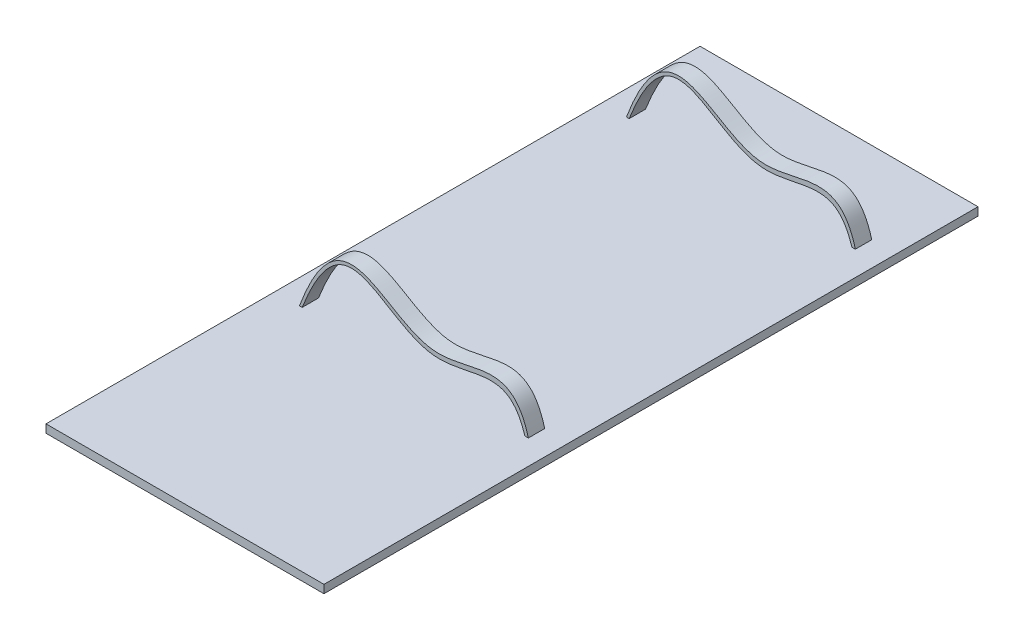
from build123d import *

# Parameters (mm, degrees)
SKETCH1_W           = 85
SKETCH1_H           = 200
BOSS_EXTRUDE1_DEPTH = 2.5
BOSS_EXTRUDE3_DEPTH = 5
LPATTERN1_COUNT     = 2
LPATTERN1_PITCH     = 100


with BuildPart() as part:
    # Sketch1 → Boss-Extrude1 (new body)
    with BuildSketch(Plane(origin=(0, 0, 0), x_dir=(1, 0, 0), z_dir=(0, 1, 0))):
        with Locations((42.5, 100)):
            Rectangle(SKETCH1_W, SKETCH1_H)
    extrude(amount=BOSS_EXTRUDE1_DEPTH)

    # Sketch3 → Boss-Extrude3 (add)
    with BuildSketch(Plane(origin=(0, 0, -175), x_dir=(-1, 0, 0), z_dir=(0, 0, -1))):
        with BuildLine():
            Line((-77.5, 2.5), (-76.450132059, 2.5))
            add(Edge.make_bspline(
                [(-76.450132059, 2.5), (-76.352037023, 2.813155952), (-76.141653781, 3.448774979), (-75.712920238, 4.60640845), (-75.141711698, 5.914949297), (-74.412627596, 7.255247487), (-73.387535674, 8.763975464), (-72.02254847, 10.166201705), (-70.263673421, 11.232606933), (-68.348427729, 11.819901852), (-65.552395249, 12.079641822), (-61.64077912, 11.600566429), (-56.547104343, 10.479098709), (-52.154053067, 9.794168924), (-48.61006882, 9.853555219), (-45.138239485, 10.48501356), (-41.055154093, 12.11371223), (-36.455574443, 14.746231277), (-32.098424566, 17.443496584), (-27.955000453, 19.605965858), (-24.067408798, 20.651525579), (-21.036519902, 20.26070597), (-18.540531077, 18.923836601), (-16.603695352, 17.289307939), (-14.606368482, 14.925983967), (-12.900683609, 12.280076139), (-11.514973715, 9.719991389), (-10.466169356, 7.570851399), (-9.58244987, 5.576333061), (-8.874263801, 3.865936613), (-8.511972004, 2.951657976), (-8.336705052, 2.5)],
                knots=[0, 0, 0, 0, 0.0078125, 0.015625, 0.03125, 0.046875, 0.0625, 0.09375, 0.125, 0.15625, 0.1875, 0.25, 0.3125, 0.375, 0.40625, 0.4375, 0.5, 0.5625, 0.625, 0.6875, 0.75, 0.8125, 0.84375, 0.875, 0.90625, 0.9375, 0.953125, 0.96875, 0.984375, 0.9921875, 1, 1, 1, 1], degree=3))
            Line((-8.336705052, 2.5), (-7.5, 2.5))
            add(Edge.make_bspline(
                [(-77.5, 2.5), (-72.458418192, 21.091936155), (-41.386339311, -5.263286213), (-20.750377369, 38.155046939), (-7.5, 2.5)],
                knots=[0, 0, 0, 0, 0.411408499, 1, 1, 1, 1], degree=3))
        make_face()
    boss_extrude3 = extrude(amount=-BOSS_EXTRUDE3_DEPTH)

    # LPattern1: Boss-Extrude3 ×2
    with Locations(*[(0, 0, i * LPATTERN1_PITCH) for i in range(1, LPATTERN1_COUNT)]):
        add(boss_extrude3)


solid = part.part
